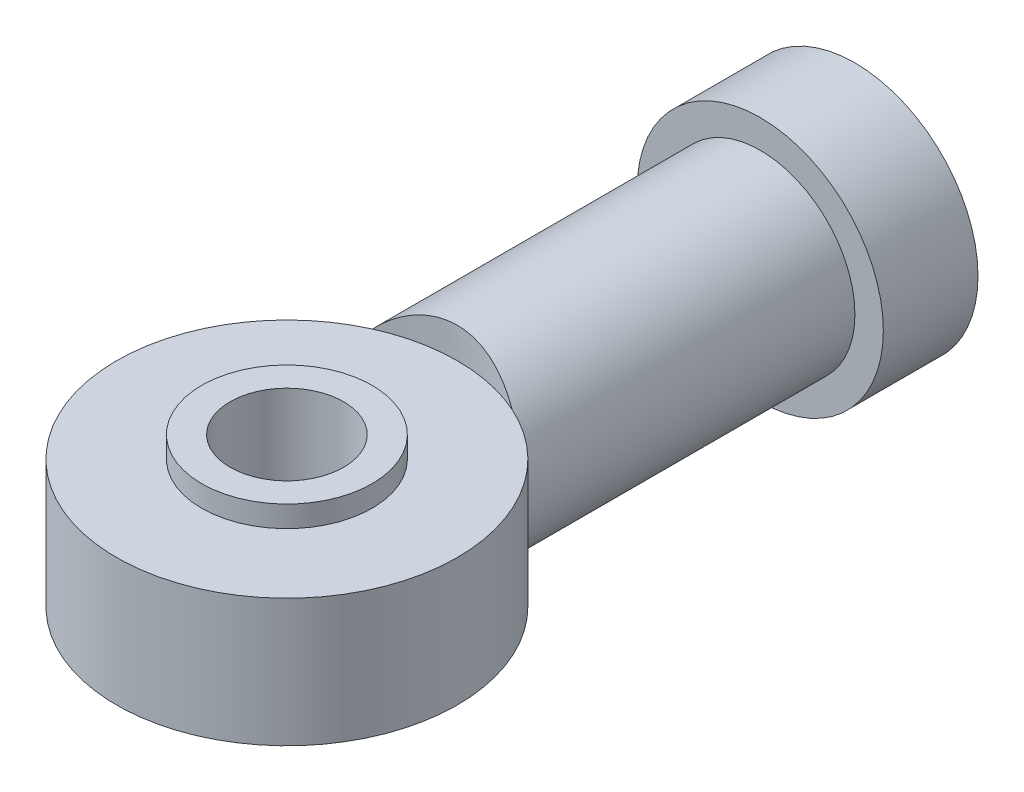
from build123d import *

# Parameters (mm, degrees)
SKETCH_2_R             = 6.5
EXTRUDE_1_DEPTH        = 5
SKETCH_3_R             = 9
EXTRUDE_2_DEPTH        = 6.5
SKETCH_4_R             = 3
CUT_EXTRUDE_1_DEPTH    = 18
EXTRUDE_3_REACH        = 37.767
EXTRUDE_3_END_RADIUS   = 9
SKETCH_7_R             = 5
SKETCH_8_R             = 9
CUT_EXTRUDE_6_DEPTH    = 2
SKETCH_11_R            = 9
SKETCH_11_R_2          = 4.5
CUT_EXTRUDE_8_DEPTH    = 1.125
HOLE_WIZARD_M6_3_D     = 5
HOLE_WIZARD_M6_3_DEPTH = 17
HOLE_WIZARD_M6_3_TIP   = 1.502151548


with BuildPart() as part:
    # 草图2 → 凸台-拉伸1 (new body)
    with BuildSketch(Plane.XY):
        Circle(SKETCH_2_R)
    extrude(amount=EXTRUDE_1_DEPTH)



with BuildPart() as body_2:
    # 草图3 → 凸台-拉伸2 (new, symmetric)
    with BuildSketch(Plane(origin=(0, 0, 0), x_dir=(1, 0, 0), z_dir=(0, 1, 0))):
        with Locations(Location((0, -30, 0), (0, 0, 90))):
            Circle(SKETCH_3_R)
    extrude(amount=EXTRUDE_2_DEPTH, both=True)

    # 草图4 → 切除-拉伸1 (cut)
    with BuildSketch(Plane(origin=(0, 6.5, 0), x_dir=(1, 0, 0), z_dir=(0, 1, 0))):
        with Locations(Location((0, -30, 0), (0, 0, 270))):
            Circle(SKETCH_4_R)
    extrude(amount=-CUT_EXTRUDE_1_DEPTH, mode=Mode.SUBTRACT)


with BuildPart() as part_1:
    add(part.part)

    add(body_2.part)  # 凸台-拉伸3 merges body 2
    # 凸台-拉伸3: up to this cylinder (the profile starts outside it)
    extrude_3_end = Plane(origin=(0, 0, 30), z_dir=(0, -1, 0)) * Cylinder(EXTRUDE_3_END_RADIUS, 94.534, mode=Mode.PRIVATE)
    # 草图7 → 凸台-拉伸3 (add, up to the surface)
    with BuildSketch(Plane.XY.offset(5), mode=Mode.PRIVATE) as extrude_3_sk1:
        with Locations(Location((0, 0, 0), (0, 0, 180))):
            Circle(SKETCH_7_R)
    extrude_3_tool1 = extrude(extrude_3_sk1.sketch, amount=EXTRUDE_3_REACH, mode=Mode.PRIVATE) - extrude_3_end
    add(extrude_3_tool1.solids().sort_by_distance((0, 0, 5))[0])

    # 草图8 → 切除-拉伸6 (cut)
    with BuildSketch(Plane(origin=(0, 6.5, 0), x_dir=(1, 0, 0), z_dir=(0, 1, 0))):
        with Locations(Location((0, -30, 0), (0, 0, 75.985881611))):
            Circle(SKETCH_8_R)
    cut_extrude_6 = extrude(amount=-CUT_EXTRUDE_6_DEPTH, mode=Mode.SUBTRACT)

    # 镜向2: 切除-拉伸6 across plane
    add(cut_extrude_6.mirror(Plane.ZX), mode=Mode.SUBTRACT)

    # 草图11 → 切除-拉伸8 (cut)
    with BuildSketch(Plane(origin=(0, 4.5, 0), x_dir=(1, 0, 0), z_dir=(0, 1, 0))):
        with Locations((0, -30)):
            Circle(SKETCH_11_R)
        with Locations(Location((0, -30, 0), (0, 0, 270))):
            Circle(SKETCH_11_R_2, mode=Mode.SUBTRACT)
    cut_extrude_8 = extrude(amount=-CUT_EXTRUDE_8_DEPTH, mode=Mode.SUBTRACT)

    # 镜向3: 切除-拉伸8 across plane
    add(cut_extrude_8.mirror(Plane.ZX), mode=Mode.SUBTRACT)

    # M6 螺纹孔3
    with Locations(Plane(origin=(0, 0, 0), x_dir=(-1, 0, 0), z_dir=(0, 0, -1))):
        with Locations((0, 0)):
            Hole(HOLE_WIZARD_M6_3_D / 2, depth=HOLE_WIZARD_M6_3_DEPTH)
            with Locations((0, 0, -(HOLE_WIZARD_M6_3_DEPTH + HOLE_WIZARD_M6_3_TIP / 2))):  # 118° drill point
                Cone(0, HOLE_WIZARD_M6_3_D / 2, HOLE_WIZARD_M6_3_TIP, mode=Mode.SUBTRACT)


solid = part_1.part
